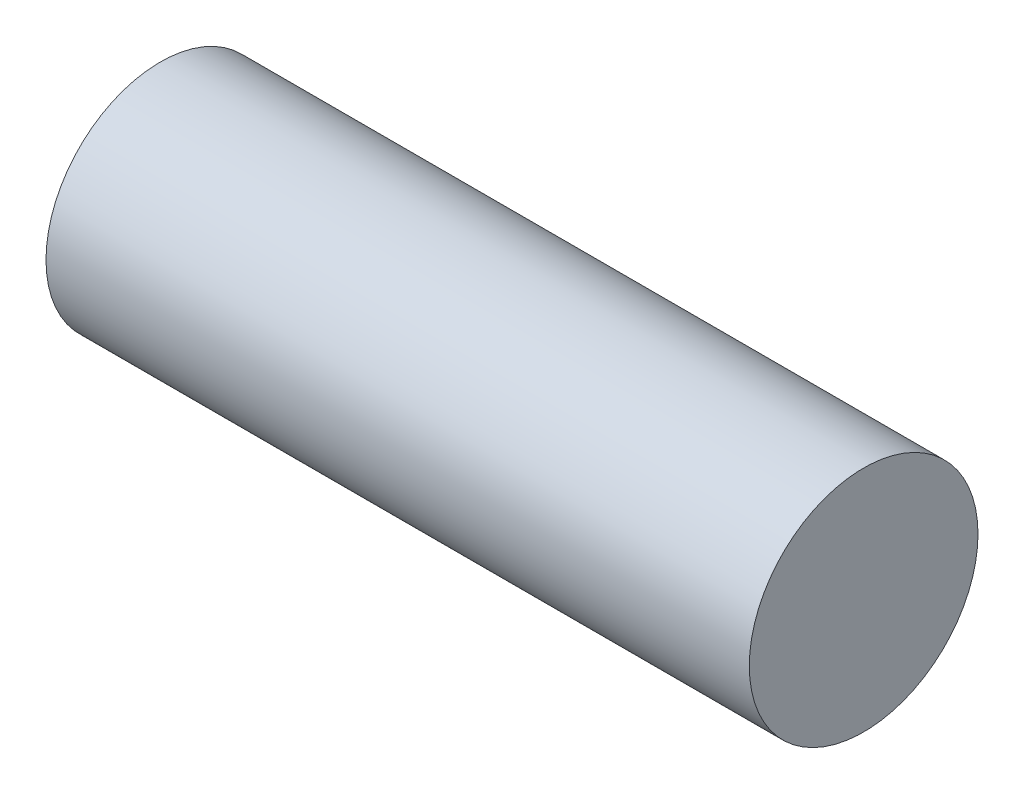
from build123d import *

# Parameters (mm, degrees)
PIN_OUTER_SKETCH_W      = 18.75
PIN_OUTER_SKETCH_H      = 3
CLEAR_THE_WALL_SKETCH_W = 1.3
CLEAR_THE_WALL_SKETCH_H = 4


with BuildPart() as part:
    # Pin_Outer Sketch → Pin_Outer (revolve)
    with BuildSketch(Plane.XY):
        with Locations((89.875, 1.5)):
            Rectangle(PIN_OUTER_SKETCH_W, PIN_OUTER_SKETCH_H)
    revolve(axis=Axis((-1000, 0, 0), (1, 0, 0)))

    # Clear The Wall Sketch → Clear The Wall (revolve, cut)
    with BuildSketch(Plane.XY):
        with Locations((99.6, 2)):
            Rectangle(CLEAR_THE_WALL_SKETCH_W, CLEAR_THE_WALL_SKETCH_H)
    revolve(axis=Axis((-1000, 0, 0), (1, 0, 0)), mode=Mode.SUBTRACT)


solid = part.part
